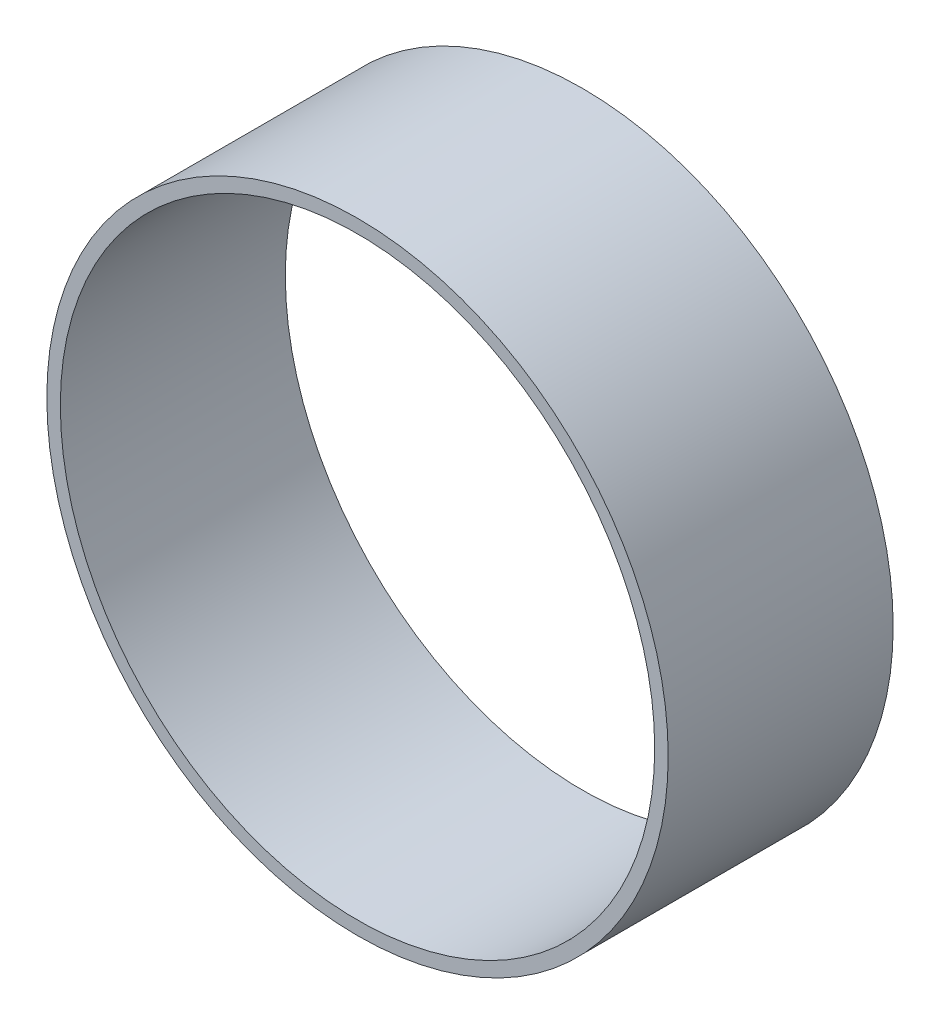
from build123d import *

# Parameters (mm, degrees)
SKETCH_1_R      = 69.05
SKETCH_1_R_2    = 66.05
EXTRUDE_1_DEPTH = 50


with BuildPart() as part:
    # Эскиз1 → Бобышка-Вытянуть1 (new body)
    with BuildSketch(Plane.XY):
        Circle(SKETCH_1_R)
        Circle(SKETCH_1_R_2, mode=Mode.SUBTRACT)
    extrude(amount=EXTRUDE_1_DEPTH)


solid = part.part
